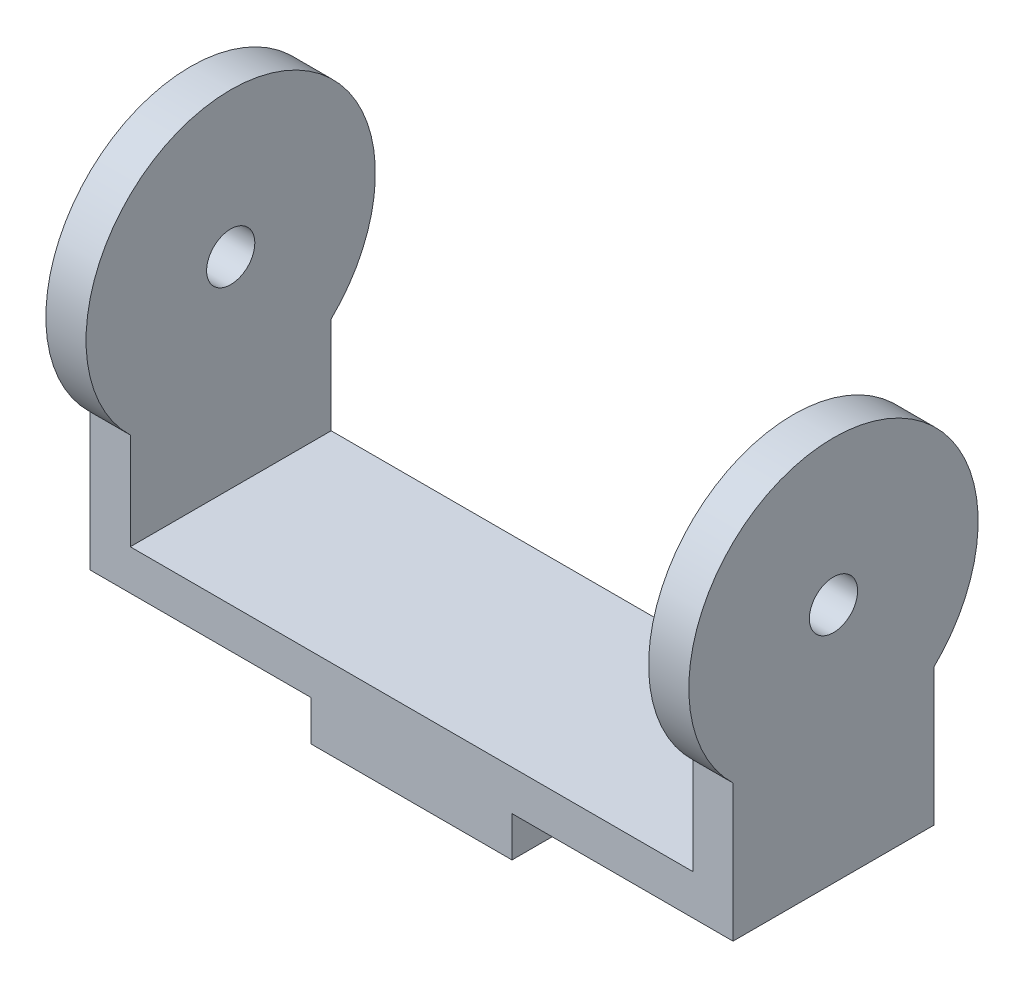
from build123d import *

# Parameters (mm, degrees)
SKETCH1_W           = 40
SKETCH1_H           = 25
BOSS_EXTRUDE1_DEPTH = 5
SKETCH6_R           = 18
SKETCH6_R_2         = 3
BOSS_EXTRUDE4_DEPTH = 5
SKETCH7_W           = 25
SKETCH7_H           = 25
BOSS_EXTRUDE5_DEPTH = 5


with BuildPart() as part:
    # Sketch1 → Boss-Extrude1 (new body)
    with BuildSketch(Plane(origin=(0, 0, 0), x_dir=(1, 0, 0), z_dir=(0, 1, 0))):
        with Locations((20, 0)):
            Rectangle(SKETCH1_W, SKETCH1_H)
    boss_extrude1 = extrude(amount=BOSS_EXTRUDE1_DEPTH)

    # Sketch6 → Boss-Extrude4 (add)
    # profile 1 of 2: a face of its own
    with BuildSketch(Plane(origin=(40, 0, 0), x_dir=(0, 0, -1), z_dir=(1, 0, 0))):
        with Locations((0, 30)):
            Circle(SKETCH6_R)
        with Locations((0, 30)):
            Circle(SKETCH6_R_2, mode=Mode.SUBTRACT)
    # profile 2 of 2: a face of its own
    with BuildSketch(Plane(origin=(40, 0, 0), x_dir=(0, 0, -1), z_dir=(1, 0, 0))):
        with BuildLine():
            ThreePointArc((12.5, 17.048166153), (0, 12), (-12.5, 17.048166153))
            Line((-12.5, 17.048166153), (-12.5, 5))
            Line((-12.5, 5), (12.5, 5))
            Line((12.5, 5), (12.5, 17.048166153))
        make_face()
    boss_extrude4 = extrude(amount=-BOSS_EXTRUDE4_DEPTH)

    # Mirror2: Boss-Extrude1, Boss-Extrude4 across plane
    add(boss_extrude1.mirror(Plane(origin=(0, 5, -12.5), x_dir=(0, 0, 1), z_dir=(1, 0, 0))))
    add(boss_extrude4.mirror(Plane(origin=(0, 5, -12.5), x_dir=(0, 0, 1), z_dir=(1, 0, 0))))

    # Sketch7 → Boss-Extrude5 (add)
    with BuildSketch(Plane.XZ):
        Rectangle(SKETCH7_W, SKETCH7_H)
    extrude(amount=BOSS_EXTRUDE5_DEPTH)


solid = part.part
